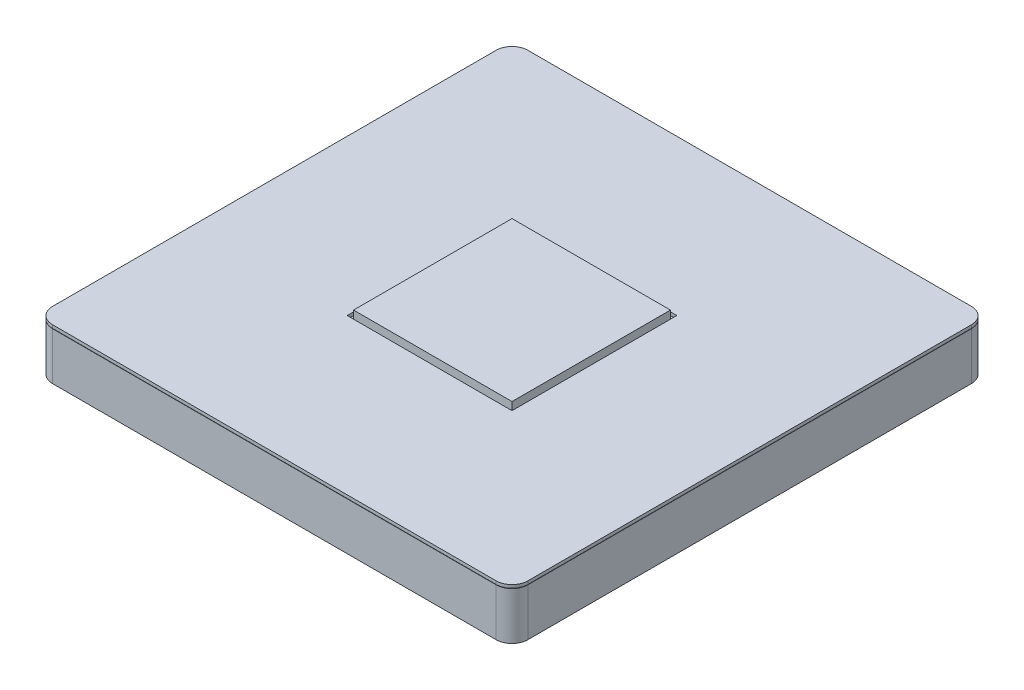
from build123d import *

# Parameters (mm, degrees)
SKETCH_1_W      = 15
SKETCH_1_H      = 15
EXTRUDE_1_DEPTH = 1.5
FILLET_1_R      = 0.5
EXTRUDE_START   = 0.1
SKETCH_2_W      = 5.2
SKETCH_2_H      = 5.2
EXTRUDE_2_DEPTH = 0.1
SKETCH_3_W      = 5
SKETCH_3_H      = 5
EXTRUDE_3_DEPTH = 0.25


with BuildPart() as part:
    # 草图1 → 凸台-拉伸1 (new body)
    with BuildSketch(Plane(origin=(0, 0, 0), x_dir=(1, 0, 0), z_dir=(0, 1, 0))):
        Rectangle(SKETCH_1_W, SKETCH_1_H)
    extrude(amount=EXTRUDE_1_DEPTH)

    # 圆角1
    fillet_1_edges = [part.edges().sort_by_distance(p)[0] for p in [
        (7.5, 0.75, 7.5),
        (-7.5, 0.75, 7.5),
        (-7.5, 0.75, -7.5),
        (7.5, 0.75, -7.5),
    ]]
    fillet(fillet_1_edges, radius=FILLET_1_R)


with BuildPart() as body_2:
    # 草图2 → 凸台-拉伸2 (new body)
    with BuildSketch(Plane(origin=(0, 1.51, 0), x_dir=(1, 0, 0), z_dir=(0, 1, 0)).offset(EXTRUDE_START)):
        with BuildLine():
            Line((-7.5, 7), (-7.5, -7))
            ThreePointArc((-7.5, -7), (-7.353553391, -7.353553391), (-7, -7.5))
            Line((-7, -7.5), (7, -7.5))
            ThreePointArc((7, -7.5), (7.353553391, -7.353553391), (7.5, -7))
            Line((7.5, -7), (7.5, 7))
            ThreePointArc((7.5, 7), (7.353553391, 7.353553391), (7, 7.5))
            Line((7, 7.5), (-7, 7.5))
            ThreePointArc((-7, 7.5), (-7.353553391, 7.353553391), (-7.5, 7))
        make_face()
        Rectangle(SKETCH_2_W, SKETCH_2_H, mode=Mode.SUBTRACT)
    extrude(amount=-EXTRUDE_2_DEPTH)


with BuildPart() as body_3:
    # 草图3 → 凸台-拉伸3 (new body)
    with BuildSketch(Plane(origin=(0, 1.51, 0), x_dir=(1, 0, 0), z_dir=(0, 1, 0))):
        Rectangle(SKETCH_3_W, SKETCH_3_H)
    extrude(amount=EXTRUDE_3_DEPTH)


solid = Compound([part.part, body_2.part, body_3.part])
